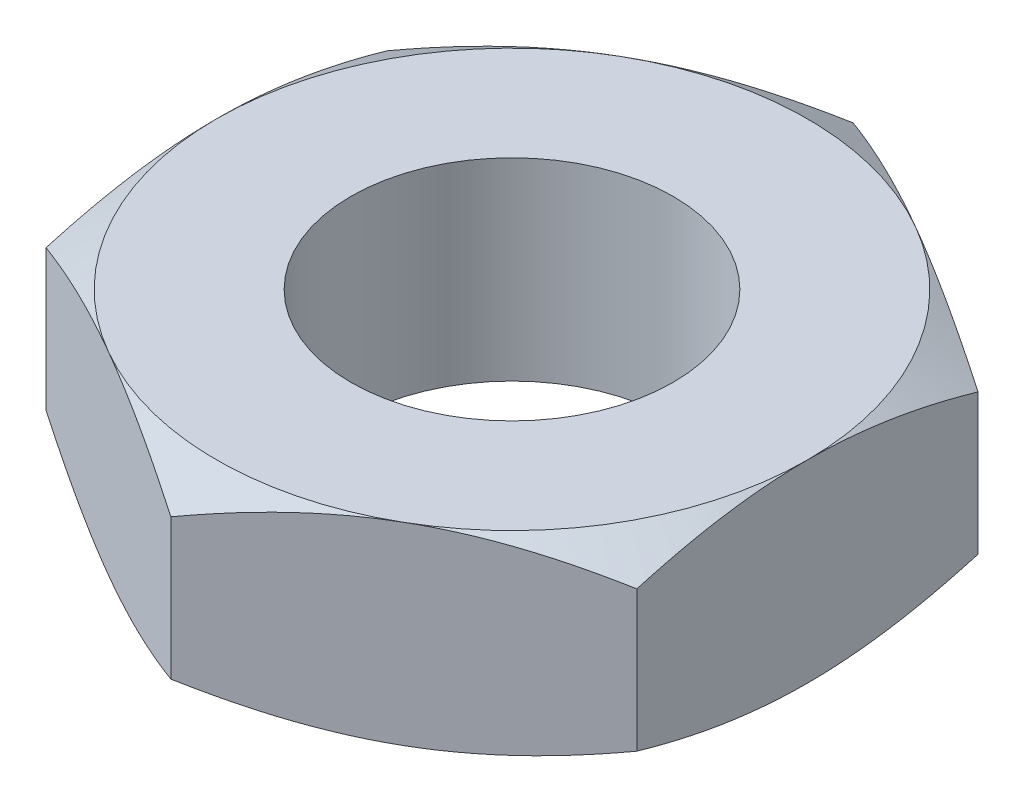
from build123d import *

# Parameters (mm, degrees)
SKETCH1_R               = 1.5
BOSS_EXTRUDE1_DEPTH     = 0.9
SKETCH5_OUTSIDE_W       = 28.514
SKETCH5_OUTSIDE_H       = 29.364
SKETCH5_OUTSIDE_R       = 2.75
CUT_EXTRUDE2_DEPTH      = 5.570102114
CUT_EXTRUDE2_DRAFT      = -60
MIRROR1_COPY_1_SKETCH_W = 28.514
MIRROR1_COPY_1_SKETCH_H = 29.364
MIRROR1_COPY_1_SKETCH_R = 2.75
MIRROR1_COPY_1_DEPTH    = 5.570102114
MIRROR1_COPY_1_DRAFT    = -60


with BuildPart() as part:
    # Sketch1 → Boss-Extrude1 (new, symmetric)
    with BuildSketch(Plane(origin=(0, 0, 0), x_dir=(1, 0, 0), z_dir=(0, 1, 0))):
        Polygon((-2.75, 1.58771324), (-2.75, -1.58771324), (0, -3.175426481), (2.75, -1.58771324), (2.75, 1.58771324), (0, 3.175426481), align=None)
        with Locations(Location((0, 0, 0), (0, 0, 270))):
            Circle(SKETCH1_R, mode=Mode.SUBTRACT)
    extrude(amount=BOSS_EXTRUDE1_DEPTH, both=True)


with BuildPart() as cut_extrude2_tool:
    # Sketch5 outside → Cut-Extrude2 (with draft: the straight prism first)
    with BuildSketch(Plane(origin=(0, 0.9, 0), x_dir=(1, 0, 0), z_dir=(0, 1, 0))):
        Rectangle(SKETCH5_OUTSIDE_W, SKETCH5_OUTSIDE_H)
        Circle(SKETCH5_OUTSIDE_R, mode=Mode.SUBTRACT)
    extrude(amount=-CUT_EXTRUDE2_DEPTH)
    # Cut-Extrude2: the draft: its side faces are tilted about the plane it starts from
    cut_extrude2_sides = [cut_extrude2_tool.faces().sort_by_distance(p)[0] for p in [
        (0, -1.885051057, 14.682),
        (14.257, -1.885051057, 0),
        (0, -1.885051057, -14.682),
        (-14.257, -1.885051057, 0),
        (-2.75, -1.885051057, 0),
    ]]
    draft(cut_extrude2_sides, Plane(origin=(0, 0.9, 0), x_dir=(1, 0, 0), z_dir=(0, 1, 0)), CUT_EXTRUDE2_DRAFT)


with BuildPart() as part_1:
    add(part.part)

    # Cut-Extrude2: cut by cut_extrude2_tool
    add(cut_extrude2_tool.part, mode=Mode.SUBTRACT)


with BuildPart() as mirror1_copy_1_tool:
    # Mirror1 copy 1 sketch → Mirror1 copy 1 (with draft: the straight prism first)
    with BuildSketch(Plane.XZ.offset(0.9)):
        Rectangle(MIRROR1_COPY_1_SKETCH_W, MIRROR1_COPY_1_SKETCH_H)
        Circle(MIRROR1_COPY_1_SKETCH_R, mode=Mode.SUBTRACT)
    extrude(amount=-MIRROR1_COPY_1_DEPTH)
    # Mirror1 copy 1: the draft: its side faces are tilted about the plane it starts from
    mirror1_copy_1_sides = [mirror1_copy_1_tool.faces().sort_by_distance(p)[0] for p in [
        (0, 1.885051057, 14.682),
        (14.257, 1.885051057, 0),
        (0, 1.885051057, -14.682),
        (-14.257, 1.885051057, 0),
        (-2.75, 1.885051057, 0),
    ]]
    draft(mirror1_copy_1_sides, Plane.XZ.offset(0.9), MIRROR1_COPY_1_DRAFT)


with BuildPart() as part_2:
    add(part_1.part)

    # Mirror1 copy 1: cut by mirror1_copy_1_tool
    add(mirror1_copy_1_tool.part, mode=Mode.SUBTRACT)


solid = part_2.part
